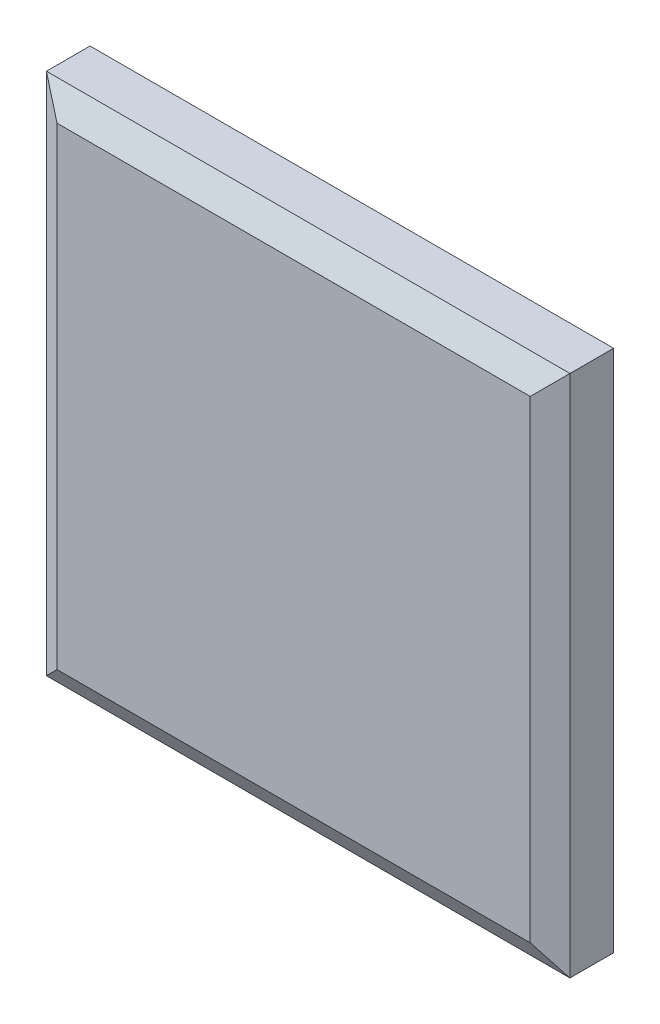
from build123d import *

# Parameters (mm, degrees)
ESBO_O1_W                = 36
ESBO_O1_H                = 36
RESSALTO_EXTRUS_O1_DEPTH = 1
RESSALTO_EXTRUS_O1_TAPER = 60
RESSALTO_EXTRUS_O2_DEPTH = 3
ESBO_O2_W                = 36
ESBO_O2_H                = 36
ESBO_O2_W_2              = 32
ESBO_O2_H_2              = 7
RESSALTO_EXTRUS_O3_DEPTH = 1
RESSALTO_EXTRUS_O3_TAPER = 60


with BuildPart() as part:
    # Esboço1 → Ressalto-extrusão1 (new body)
    with BuildSketch(Plane.XY):
        with Locations((0, 15)):
            Rectangle(ESBO_O1_W, ESBO_O1_H)
    extrude(amount=RESSALTO_EXTRUS_O1_DEPTH, taper=RESSALTO_EXTRUS_O1_TAPER)

    # Esboço1<4> → Ressalto-extrusão2 (add)
    with BuildSketch(Plane.XY):
        Polygon((16, 31), (16, -1), (16, -3), (18, -3), (18, 33), (0, 33), (-18, 33), (-18, -3), (-16, -3), (-16, -1), (-16, 31), (0, 31), align=None)
    extrude(amount=-RESSALTO_EXTRUS_O2_DEPTH)

    # Esboço2 → Ressalto-extrusão3 (add)
    with BuildSketch(Plane(origin=(0, 0, -3), x_dir=(-1, 0, 0), z_dir=(0, 0, -1))):
        with Locations((0, 15)):
            Rectangle(ESBO_O2_W, ESBO_O2_H)
        with Locations((0, 7.5)):
            Rectangle(ESBO_O2_W_2, ESBO_O2_H_2, mode=Mode.SUBTRACT)
    extrude(amount=RESSALTO_EXTRUS_O3_DEPTH, taper=RESSALTO_EXTRUS_O3_TAPER)


solid = part.part
